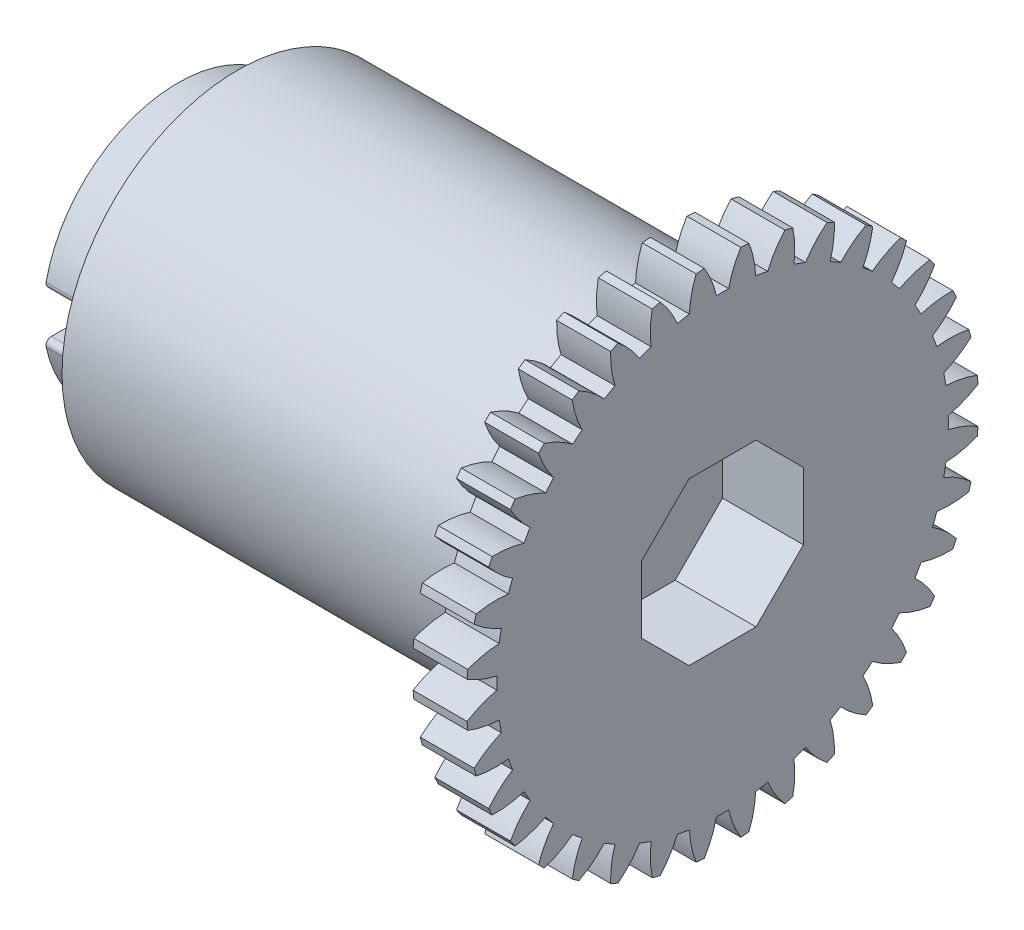
from build123d import *

# Parameters (mm, degrees)
CORTAR_EXTRUIR2_START = -10
CORTAR_EXTRUIR2_DEPTH = 10
MATRIZC1_COUNT        = 36
CORTAR_EXTRUIR3_DEPTH = 6
CORTAR_EXTRUIR4_DEPTH = 6
CORTAR_EXTRUIR5_DEPTH = 4.4
REDONDEO1_R           = 0.4
CHAFL_N2_SIZE         = 0.4


with BuildPart() as part:
    # Croquis1 → Revolución1 (revolve)
    with BuildSketch(Plane(origin=(0, 0, 0), x_dir=(0, 1, 0), z_dir=(0, 0, 1)), mode=Mode.PRIVATE) as revoluci_n1_sk:
        Polygon((0, 0), (19, 0), (19, 4), (13, 4), (13, 36), (10, 36), (10, 40.4), (0, 40.4), align=None)
    revolve(revoluci_n1_sk.sketch.rotate(Axis((0, 0, 0), (-1, 0, 0)), 90), axis=Axis((0, 0, 0), (-1, 0, 0)))

    # Croquis2 → Cortar-Extruir2 (cut)
    with BuildSketch(Plane.YZ.offset(CORTAR_EXTRUIR2_START)):
        with BuildLine():
            ThreePointArc((0.454664826, 16.742827745), (0.812137709, 17.88475427), (1.353795001, 18.951708079))
            ThreePointArc((1.353795001, 18.951708079), (0, 19), (-1.353795001, 18.951708079))
            ThreePointArc((-1.353795001, 18.951708079), (-0.812137709, 17.88475427), (-0.454664826, 16.742827745))
            ThreePointArc((-0.454664826, 16.742827745), (0, 16.749), (0.454664826, 16.742827745))
        make_face()
    cortar_extruir2 = extrude(amount=CORTAR_EXTRUIR2_DEPTH, mode=Mode.SUBTRACT)

    # MatrizC1: Cortar-Extruir2 ×36 about axis
    matrizc1_axis = Axis((0, 0, 0), (1, 0, 0))
    for i in range(1, MATRIZC1_COUNT):
        add(cortar_extruir2.rotate(matrizc1_axis, i * 360 / MATRIZC1_COUNT), mode=Mode.SUBTRACT)

    # Croquis3 → Cortar-Extruir3 (cut)
    with BuildSketch(Plane.YZ):
        Polygon((2.485281374, -6), (6, -2.485281374), (6, 2.485281374), (2.485281374, 6), (-2.485281374, 6), (-6, 2.485281374), (-6, -2.485281374), (-2.485281374, -6), align=None)
    extrude(amount=-CORTAR_EXTRUIR3_DEPTH, mode=Mode.SUBTRACT)

    # Croquis4 → Cortar-Extruir4 (cut)
    with BuildSketch(Plane(origin=(-40.4, 0, 0), x_dir=(0, -1, 0), z_dir=(-1, 0, 0))):
        Polygon((6, -2.485281374), (6, 2.485281374), (2.485281374, 6), (-2.485281374, 6), (-6, 2.485281374), (-6, -2.485281374), (-2.485281374, -6), (2.485281374, -6), align=None)
    extrude(amount=-CORTAR_EXTRUIR4_DEPTH, mode=Mode.SUBTRACT)

    # Croquis5 → Cortar-Extruir5 (cut)
    with BuildSketch(Plane(origin=(-40.4, 0, 0), x_dir=(0, -1, 0), z_dir=(-1, 0, 0))):
        with BuildLine():
            Line((-1.6, 7.6), (1.6, 7.6))
            Line((1.6, 7.6), (1.6, 9.871170143))
            ThreePointArc((1.6, 9.871170143), (0, 10), (-1.6, 9.871170143))
            Line((-1.6, 9.871170143), (-1.6, 7.6))
        make_face()
    extrude(amount=-CORTAR_EXTRUIR5_DEPTH, mode=Mode.SUBTRACT)

    # Redondeo1
    redondeo1_edges = [part.edges().sort_by_distance(p)[0] for p in [
        (-38.2, -1.6, 9.871170143),
        (-38.2, 1.6, 9.871170143),
    ]]
    fillet(redondeo1_edges, radius=REDONDEO1_R)

    # Chaflán2
    chafl_n2_edges = [part.edges().sort_by_distance(p)[0] for p in [
        (-38.2, -1.6, 7.6),
        (-38.2, 1.6, 7.6),
    ]]
    chamfer(chafl_n2_edges, length=CHAFL_N2_SIZE)


solid = part.part
